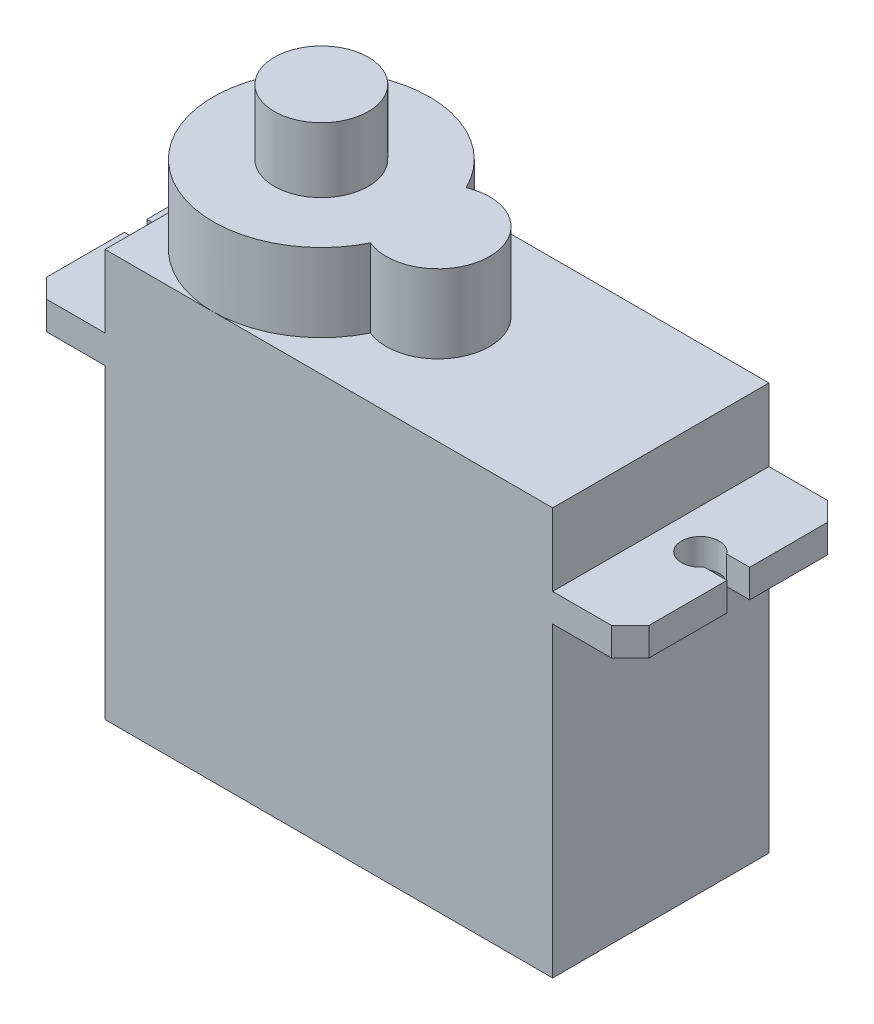
from build123d import *

# Parameters (mm, degrees)
SKETCH_1_W          = 23.8
SKETCH_1_H          = 11.5
EXTRUDE_1_DEPTH     = 21.65
EXTRUDE_START       = -16.3
SKETCH_2_W          = 32.05
SKETCH_2_H          = 11.5
EXTRUDE_2_DEPTH     = 1.5
SKETCH_3_R          = 2.75
SKETCH_3_R_2        = 5.75
EXTRUDE_3_DEPTH     = 4.15
SKETCH_4_R          = 2.5
EXTRUDE_4_DEPTH     = 3.45
CHAMFER_1_SIZE      = 1
CUT_EXTRUDE_1_REACH = 26.631
SKETCH_5_R          = 1


with BuildPart() as part:
    # 草图1 → 凸台-拉伸1 (new body)
    with BuildSketch(Plane(origin=(0, 0, 0), x_dir=(1, 0, 0), z_dir=(0, 1, 0))):
        Rectangle(SKETCH_1_W, SKETCH_1_H)
    extrude(amount=EXTRUDE_1_DEPTH)

    # 草图2 → 凸台-拉伸2 (add)
    with BuildSketch(Plane.XZ.offset(EXTRUDE_START)):
        Rectangle(SKETCH_2_W, SKETCH_2_H)
    extrude(amount=-EXTRUDE_2_DEPTH)

    # 草图3 → 凸台-拉伸3 (add)
    with BuildSketch(Plane(origin=(0, 21.65, 0), x_dir=(1, 0, 0), z_dir=(0, 1, 0))):
        with Locations((0.05, 0)):
            Circle(SKETCH_3_R)
        with Locations((-6.15, 0)):
            Circle(SKETCH_3_R_2)
    extrude(amount=EXTRUDE_3_DEPTH)

    # 草图4 → 凸台-拉伸4 (add)
    with BuildSketch(Plane(origin=(0, 25.8, 0), x_dir=(1, 0, 0), z_dir=(0, 1, 0))):
        with Locations(Location((-6.15, 0, 0), (0, 0, 90))):
            Circle(SKETCH_4_R)
    extrude(amount=EXTRUDE_4_DEPTH)

    # 倒角1
    chamfer_1_edges = [part.edges().sort_by_distance(p)[0] for p in [
        (-16.025, 17.05, 5.75),
        (16.025, 17.05, -5.75),
        (-16.025, 17.05, -5.75),
        (16.025, 17.05, 5.75),
    ]]
    chamfer(chamfer_1_edges, length=CHAMFER_1_SIZE)

    # 草图5 → 切除-拉伸1 (cut, up to next)
    with BuildSketch(Plane(origin=(0, 17.8, 0), x_dir=(1, 0, 0), z_dir=(0, 1, 0)), mode=Mode.PRIVATE) as cut_extrude_1_sk1:
        with Locations((14, 0)):
            Circle(SKETCH_5_R)
    cut_extrude_1_tool1 = extrude(cut_extrude_1_sk1.sketch, amount=-CUT_EXTRUDE_1_REACH, mode=Mode.PRIVATE) & part.part
    # 草图5 → 切除-拉伸1 (cut, up to next)
    with BuildSketch(Plane(origin=(0, 17.8, 0), x_dir=(1, 0, 0), z_dir=(0, 1, 0)), mode=Mode.PRIVATE) as cut_extrude_1_sk2:
        with BuildLine():
            Line((16.025, -0.6), (16.025, 0.6))
            Line((16.025, 0.6), (14.8, 0.6))
            ThreePointArc((14.8, 0.6), (14.948683298, 0.316227766), (15, 0))
            ThreePointArc((15, 0), (14.948683298, -0.316227766), (14.8, -0.6))
            Line((14.8, -0.6), (16.025, -0.6))
        make_face()
    cut_extrude_1_tool2 = extrude(cut_extrude_1_sk2.sketch, amount=-CUT_EXTRUDE_1_REACH, mode=Mode.PRIVATE) & part.part
    cut_extrude_1_1 = cut_extrude_1_tool1.solids().sort_by_distance((14, 17.8, 0))[0]
    add(cut_extrude_1_1, mode=Mode.SUBTRACT)
    cut_extrude_1_2 = cut_extrude_1_tool2.solids().sort_by_distance((15.479048, 17.8, 0))[0]
    add(cut_extrude_1_2, mode=Mode.SUBTRACT)
    cut_extrude_1 = cut_extrude_1_1 + cut_extrude_1_2  # 切除-拉伸1 as one shape, for the pattern or mirror that repeats it

    # 镜向1: 切除-拉伸1 across plane
    add(cut_extrude_1.mirror(Plane(origin=(0, 0, 0), x_dir=(0, 0, 1), z_dir=(1, 0, 0))), mode=Mode.SUBTRACT)


solid = part.part
